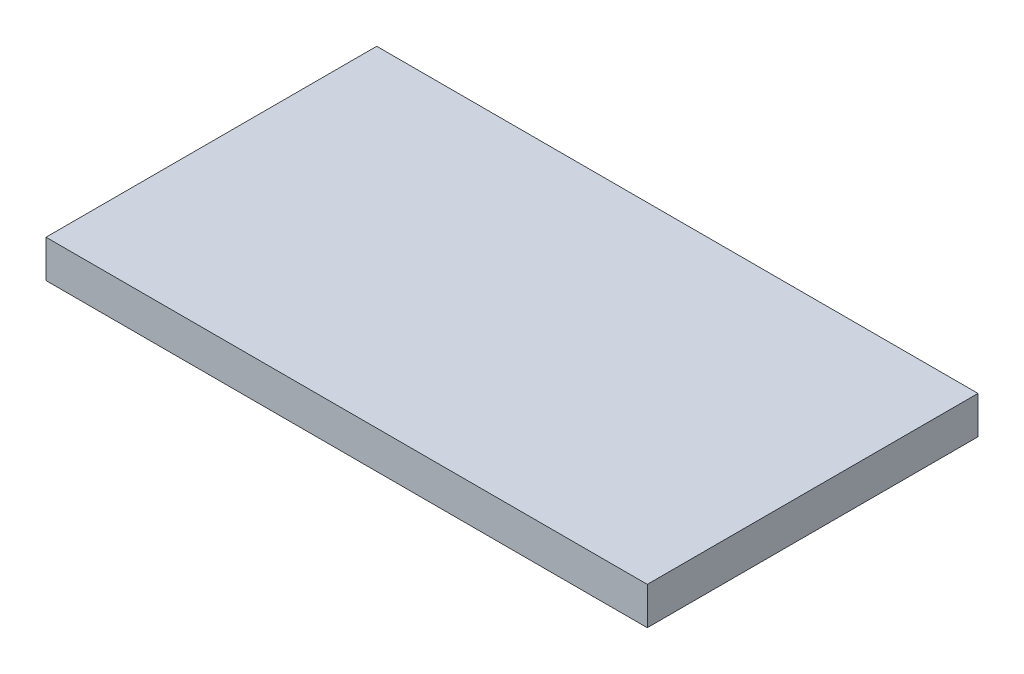
from build123d import *

# Parameters (mm, degrees)
SKETCH1_W           = 160
SKETCH1_H           = 88
BOSS_EXTRUDE1_DEPTH = 10


with BuildPart() as part:
    # Sketch1 → Boss-Extrude1 (new body)
    with BuildSketch(Plane(origin=(0, 0, 0), x_dir=(1, 0, 0), z_dir=(0, 1, 0))):
        Rectangle(SKETCH1_W, SKETCH1_H)
    extrude(amount=BOSS_EXTRUDE1_DEPTH)


solid = part.part
